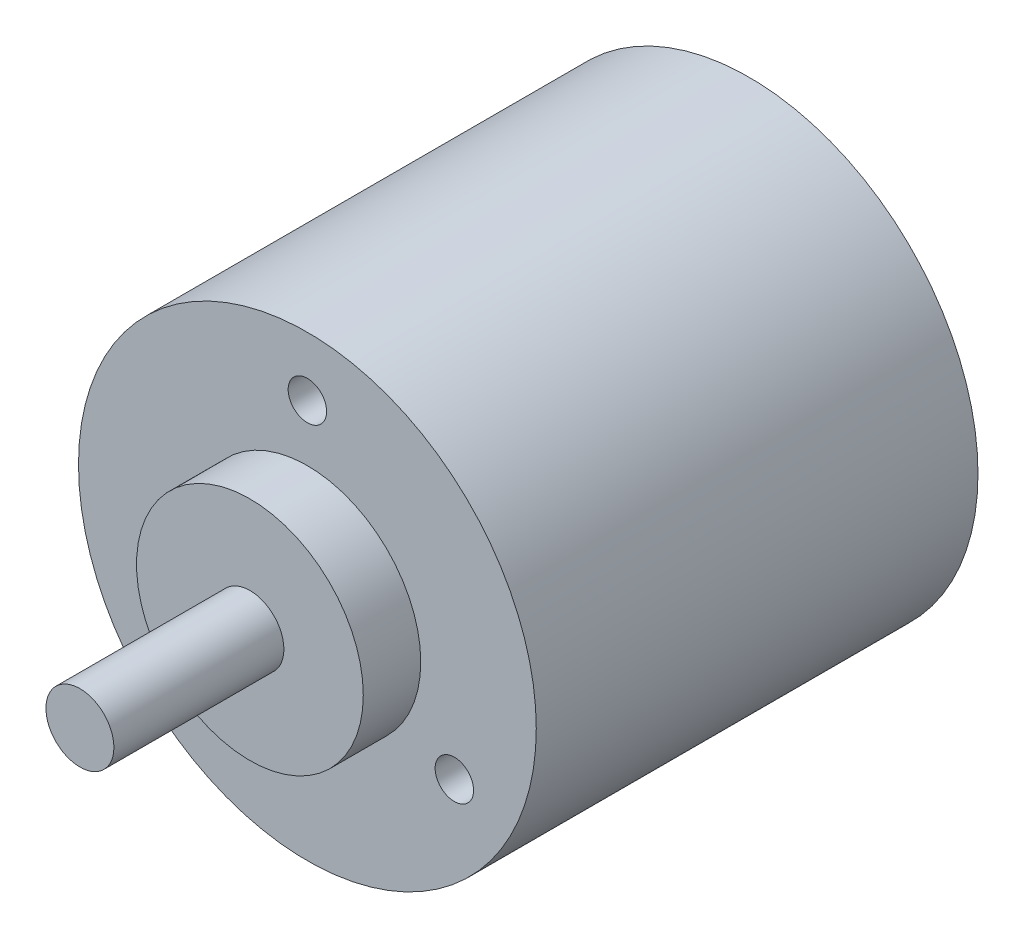
from build123d import *

# Parameters (mm, degrees)
SKETCH1_R                = 20.2311
BOSS_EXTRUDE1_DEPTH      = 19.5199
SKETCH2_R                = 10.0203
BOSS_EXTRUDE2_DEPTH      = 5.08
SKETCH3_R                = 3.00355
BOSS_EXTRUDE3_DEPTH      = 15.0241
M3_CLEARANCE_HOLE1_D     = 3.4
M3_CLEARANCE_HOLE1_DEPTH = 7.0000114
M3_CLEARANCE_HOLE1_TIP   = 1.021463052


with BuildPart() as part:
    # Sketch1 → Boss-Extrude1 (new, symmetric)
    with BuildSketch(Plane.XY):
        Circle(SKETCH1_R)
    extrude(amount=BOSS_EXTRUDE1_DEPTH, both=True)

    # Sketch2 → Boss-Extrude2 (add)
    with BuildSketch(Plane.XY.offset(19.5199)):
        Circle(SKETCH2_R)
    extrude(amount=BOSS_EXTRUDE2_DEPTH)

    # Sketch3 → Boss-Extrude3 (add)
    with BuildSketch(Plane.XY.offset(24.5999)):
        Circle(SKETCH3_R)
    extrude(amount=BOSS_EXTRUDE3_DEPTH)

    # M3 Clearance Hole1
    with Locations(Plane.XY.offset(19.5199)):
        with Locations((0, 15), (12.990381057, -7.5), (-12.990381057, -7.5)):
            Hole(M3_CLEARANCE_HOLE1_D / 2, depth=M3_CLEARANCE_HOLE1_DEPTH)
            with Locations((0, 0, -(M3_CLEARANCE_HOLE1_DEPTH + M3_CLEARANCE_HOLE1_TIP / 2))):  # 118° drill point
                Cone(0, M3_CLEARANCE_HOLE1_D / 2, M3_CLEARANCE_HOLE1_TIP, mode=Mode.SUBTRACT)


solid = part.part
